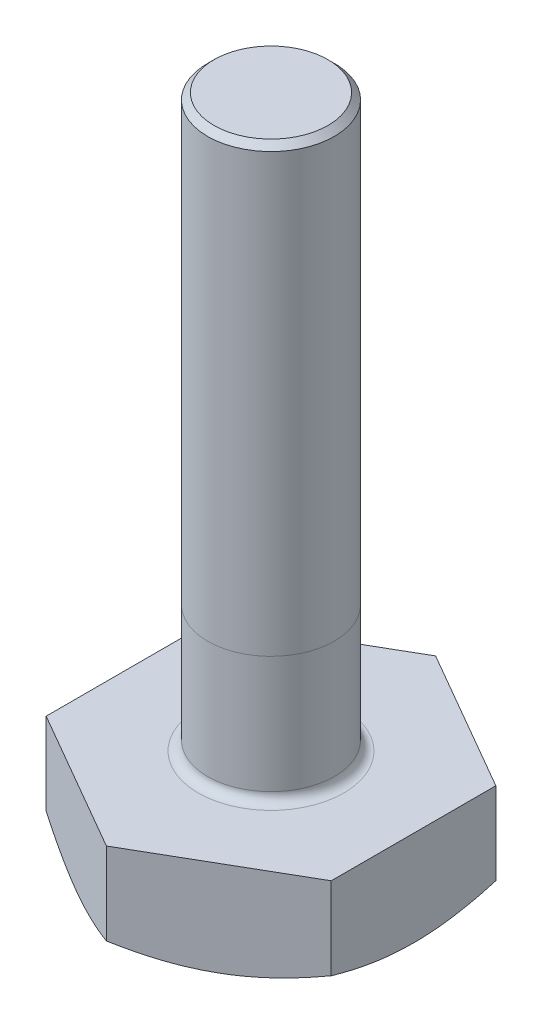
from build123d import *

# Parameters (mm, degrees)
BOSS_EXTRUDE1_DEPTH = 1.5
SKETCH3_OUTSIDE_W   = 13.104
SKETCH3_OUTSIDE_H   = 13.8
SKETCH3_OUTSIDE_R   = 2.25
CUT_EXTRUDE1_DEPTH  = 1.5
CUT_EXTRUDE1_DRAFT  = 60
SKETCH4_R           = 1
BOSS_EXTRUDE2_DEPTH = 9
CHAMFER1_SIZE       = 0.1
FILLET1_R           = 0.15


with BuildPart() as part:
    # Sketch1 → Boss-Extrude1 (new body)
    with BuildSketch(Plane(origin=(0, 0, 0), x_dir=(1, 0, 0), z_dir=(0, 1, 0))):
        Polygon((0, -2.598076211), (2.25, -1.299038106), (2.25, 1.299038106), (0, 2.598076211), (-2.25, 1.299038106), (-2.25, -1.299038106), align=None)
    extrude(amount=BOSS_EXTRUDE1_DEPTH)


with BuildPart() as cut_extrude1_tool:
    # Sketch3 outside → Cut-Extrude1 (with draft: the straight prism first)
    with BuildSketch(Plane(origin=(0, 0, 0), x_dir=(1, 0, 0), z_dir=(0, 1, 0))):
        Rectangle(SKETCH3_OUTSIDE_W, SKETCH3_OUTSIDE_H)
        Circle(SKETCH3_OUTSIDE_R, mode=Mode.SUBTRACT)
    extrude(amount=CUT_EXTRUDE1_DEPTH)
    # Cut-Extrude1: the draft: its side faces are tilted about the plane it starts from
    cut_extrude1_sides = [cut_extrude1_tool.faces().sort_by_distance(p)[0] for p in [
        (0, 0.75, 6.9),
        (6.552, 0.75, 0),
        (0, 0.75, -6.9),
        (-6.552, 0.75, 0),
        (-2.25, 0.75, 0),
    ]]
    draft(cut_extrude1_sides, Plane(origin=(0, 0, 0), x_dir=(1, 0, 0), z_dir=(0, 1, 0)), CUT_EXTRUDE1_DRAFT)


with BuildPart() as part_1:
    add(part.part)

    # Cut-Extrude1: cut by cut_extrude1_tool
    add(cut_extrude1_tool.part, mode=Mode.SUBTRACT)

    # Sketch4 → Boss-Extrude2 (add)
    with BuildSketch(Plane(origin=(0, 1.5, 0), x_dir=(1, 0, 0), z_dir=(0, 1, 0))):
        with Locations(Location((0, 0, 0), (0, 0, 270))):
            Circle(SKETCH4_R)
    extrude(amount=BOSS_EXTRUDE2_DEPTH)

    # Chamfer1
    chamfer1_edges = [part_1.edges().sort_by_distance(p)[0] for p in [
        (0, 10.5, -1),
    ]]
    chamfer(chamfer1_edges, length=CHAMFER1_SIZE)

    # Fillet1
    fillet1_edges = [part_1.edges().sort_by_distance(p)[0] for p in [
        (0, 1.5, -1),
    ]]
    fillet(fillet1_edges, radius=FILLET1_R)


solid = part_1.part
